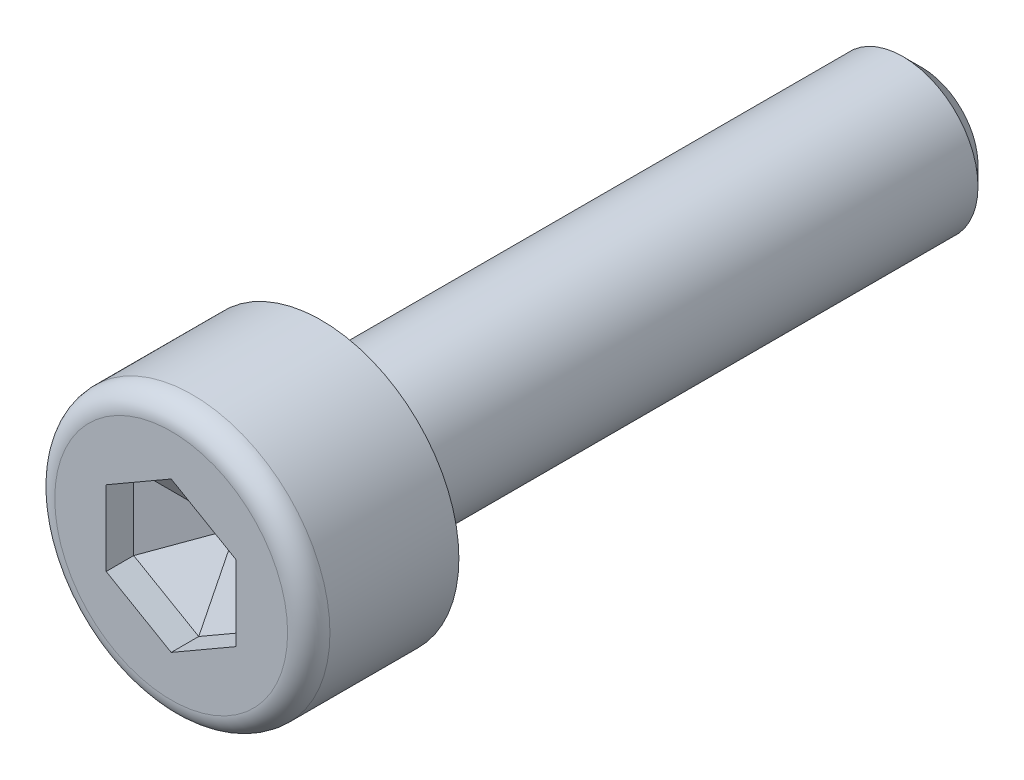
from build123d import *
from OCP.BRepFilletAPI import BRepFilletAPI_MakeChamfer

# Parameters (mm, degrees)
SKETCH_1_R          = 2.75
EXTRUDE_1_DEPTH     = 3
CUT_EXTRUDE_1_DEPTH = 1.3
SKETCH_3_R          = 1.5
EXTRUDE_2_DEPTH     = 12
CHAMFER_1_SIZE      = 0.375
FILLET_1_R          = 0.423076923
CHAMFER_2_SIZE      = 0.749279539
CHAMFER_2_SIZE2     = 1.29779023
FILLET_2_R          = 0.1


with BuildPart() as part:
    # 草图1 → 凸台-拉伸1 (new body)
    with BuildSketch(Plane.XY):
        Circle(SKETCH_1_R)
    extrude(amount=EXTRUDE_1_DEPTH)

    # 草图2 → 切除-拉伸1 (cut)
    with BuildSketch(Plane.XY.offset(3)):
        Polygon((1.3, 0.75055535), (0, 1.5011107), (-1.3, 0.75055535), (-1.3, -0.75055535), (0, -1.5011107), (1.3, -0.75055535), align=None)
    extrude(amount=-CUT_EXTRUDE_1_DEPTH, mode=Mode.SUBTRACT)

    # 草图3 → 凸台-拉伸2 (add)
    with BuildSketch(Plane(origin=(0, 0, 0), x_dir=(-1, 0, 0), z_dir=(0, 0, -1))):
        Circle(SKETCH_3_R)
    extrude(amount=EXTRUDE_2_DEPTH)

    # 倒角1
    chamfer_1_edges = [part.edges().sort_by_distance(p)[0] for p in [
        (1.5, 0, -12),
    ]]
    chamfer(chamfer_1_edges, length=CHAMFER_1_SIZE)

    # 圆角1
    fillet_1_edges = [part.edges().sort_by_distance(p)[0] for p in [
        (-2.75, 0, 3),
    ]]
    fillet(fillet_1_edges, radius=FILLET_1_R)

    # 倒角2: one chamfer whose edges measure the first distance from different faces: ONE call of the kernel's chamfer builder (chamfer() names one face for all edges)
    chamfer_2_edges_1 = [part.edges().sort_by_distance(p)[0] for p in [
        (-1.3, 0, 1.7),
    ]]
    chamfer_2_side_1 = [part.faces().sort_by_distance(p)[0] for p in [
        (-1.3, 0, 2.35),
    ]]
    chamfer_2_edges_2 = [part.edges().sort_by_distance(p)[0] for p in [
        (-0.65, 1.125833025, 1.7),
    ]]
    chamfer_2_side_2 = [part.faces().sort_by_distance(p)[0] for p in [
        (-0.65, 1.125833025, 2.35),
    ]]
    chamfer_2_edges_3 = [part.edges().sort_by_distance(p)[0] for p in [
        (0.65, 1.125833025, 1.7),
    ]]
    chamfer_2_side_3 = [part.faces().sort_by_distance(p)[0] for p in [
        (0.65, 1.125833025, 2.35),
    ]]
    chamfer_2_edges_4 = [part.edges().sort_by_distance(p)[0] for p in [
        (1.3, 0, 1.7),
    ]]
    chamfer_2_side_4 = [part.faces().sort_by_distance(p)[0] for p in [
        (1.3, 0, 2.35),
    ]]
    chamfer_2_edges_5 = [part.edges().sort_by_distance(p)[0] for p in [
        (-0.65, -1.125833025, 1.7),
    ]]
    chamfer_2_side_5 = [part.faces().sort_by_distance(p)[0] for p in [
        (-0.65, -1.125833025, 2.35),
    ]]
    chamfer_2_edges_6 = [part.edges().sort_by_distance(p)[0] for p in [
        (0.65, -1.125833025, 1.7),
    ]]
    chamfer_2_side_6 = [part.faces().sort_by_distance(p)[0] for p in [
        (0.65, -1.125833025, 2.35),
    ]]
    chamfer_2 = BRepFilletAPI_MakeChamfer(part.part.solid().wrapped)
    for e in chamfer_2_edges_1:
        chamfer_2.Add(CHAMFER_2_SIZE, CHAMFER_2_SIZE2, e.wrapped, chamfer_2_side_1[0].wrapped)  # the first distance lies on this face
    for e in chamfer_2_edges_2:
        chamfer_2.Add(CHAMFER_2_SIZE, CHAMFER_2_SIZE2, e.wrapped, chamfer_2_side_2[0].wrapped)  # the first distance lies on this face
    for e in chamfer_2_edges_3:
        chamfer_2.Add(CHAMFER_2_SIZE, CHAMFER_2_SIZE2, e.wrapped, chamfer_2_side_3[0].wrapped)  # the first distance lies on this face
    for e in chamfer_2_edges_4:
        chamfer_2.Add(CHAMFER_2_SIZE, CHAMFER_2_SIZE2, e.wrapped, chamfer_2_side_4[0].wrapped)  # the first distance lies on this face
    for e in chamfer_2_edges_5:
        chamfer_2.Add(CHAMFER_2_SIZE, CHAMFER_2_SIZE2, e.wrapped, chamfer_2_side_5[0].wrapped)  # the first distance lies on this face
    for e in chamfer_2_edges_6:
        chamfer_2.Add(CHAMFER_2_SIZE, CHAMFER_2_SIZE2, e.wrapped, chamfer_2_side_6[0].wrapped)  # the first distance lies on this face
    add(Compound.cast(chamfer_2.Shape()), mode=Mode.REPLACE)

    # 圆角2
    fillet_2_edges = [part.edges().sort_by_distance(p)[0] for p in [
        (1.5, 0, 0),
    ]]
    fillet(fillet_2_edges, radius=FILLET_2_R)


solid = part.part
